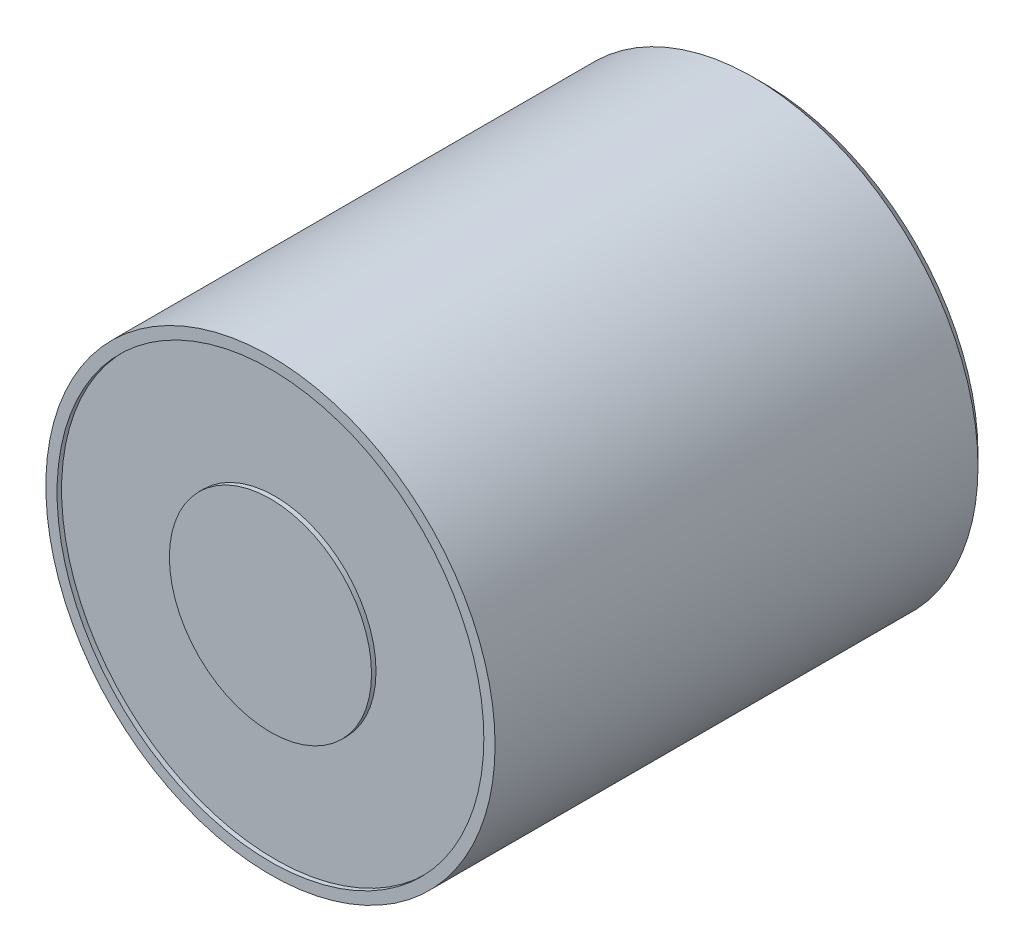
from build123d import *

# Parameters (mm, degrees)
SKETCH1_R             = 10
BOSS_EXTRUDE1_DEPTH   = 22
SKETCH2_R             = 9.5
SKETCH2_R_2           = 4.5
CUT_EXTRUDE1_DEPTH    = 0.2
M4_TAPPED_HOLE1_D     = 3.3
M4_TAPPED_HOLE1_DEPTH = 5
M4_TAPPED_HOLE1_TIP   = 0.991420021
CHAMFER2_SIZE         = 0.5


with BuildPart() as part:
    # Sketch1 → Boss-Extrude1 (new body)
    with BuildSketch(Plane.XY):
        Circle(SKETCH1_R)
    extrude(amount=BOSS_EXTRUDE1_DEPTH)

    # Sketch2 → Cut-Extrude1 (cut)
    with BuildSketch(Plane.XY.offset(22)):
        Circle(SKETCH2_R)
        Circle(SKETCH2_R_2, mode=Mode.SUBTRACT)
    extrude(amount=-CUT_EXTRUDE1_DEPTH, mode=Mode.SUBTRACT)

    # M4 Tapped Hole1
    with Locations(Plane(origin=(0, 0, 0), x_dir=(-1, 0, 0), z_dir=(0, 0, -1))):
        with Locations((0, 0)):
            Hole(M4_TAPPED_HOLE1_D / 2, depth=M4_TAPPED_HOLE1_DEPTH)
            with Locations((0, 0, -(M4_TAPPED_HOLE1_DEPTH + M4_TAPPED_HOLE1_TIP / 2))):  # 118° drill point
                Cone(0, M4_TAPPED_HOLE1_D / 2, M4_TAPPED_HOLE1_TIP, mode=Mode.SUBTRACT)

    # Chamfer2
    chamfer2_edges = [part.edges().sort_by_distance(p)[0] for p in [
        (-10, 0, 0),
    ]]
    chamfer(chamfer2_edges, length=CHAMFER2_SIZE)


solid = part.part
